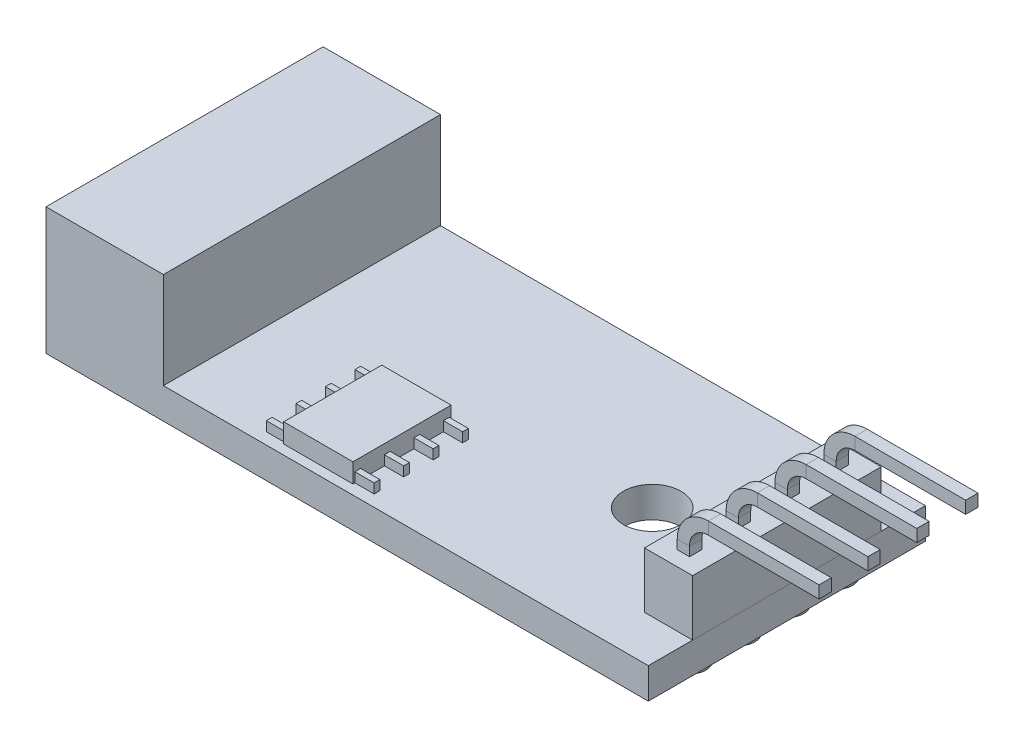
from build123d import *

# Parameters (mm, degrees)
CROQUIS1_W              = 31.3
CROQUIS1_H              = 14.4
CROQUIS1_R              = 1.5
BASE_DEPTH              = 1.6
CROQUIS2_W              = 2.5
CROQUIS2_H              = 9.8
BASE_PINES_DEPTH        = 2.9
SECCION_W               = 0.64
SECCION_H               = 0.64
MATRIZL1_COUNT          = 4
MATRIZL1_PITCH          = 2.54
CROQUIS7_W              = 3.6
CROQUIS7_H              = 5.1
SALIENTE_EXTRUIR4_DEPTH = 1
CROQUIS8_W              = 1
CROQUIS8_H              = 0.3
SALIENTE_EXTRUIR5_DEPTH = 0.5
CROQUIS9_R              = 0.85
SALIENTE_EXTRUIR6_DEPTH = 0.5
CROQUIS5_W              = 6.1
CROQUIS5_H              = 14.4
BOSS_EXTRUDE1_DEPTH     = 5


with BuildPart() as part:
    # Croquis1 → BASE (new body)
    with BuildSketch(Plane(origin=(0, 0, 0), x_dir=(1, 0, 0), z_dir=(0, 1, 0))):
        Rectangle(CROQUIS1_W, CROQUIS1_H)
        with Locations(Location((8.65, 0, 0), (0, 0, 270))):
            Circle(CROQUIS1_R, mode=Mode.SUBTRACT)
    extrude(amount=BASE_DEPTH)

    # Croquis9 → Saliente-Extruir6 (add)
    with BuildSketch(Plane.XZ):
        with Locations(Location((-13.15, 5.15, 0), (0, 0, 270))):
            Circle(CROQUIS9_R)
        with Locations(Location((-10.575, 5.15, 0), (0, 0, 270))):
            Circle(CROQUIS9_R)
        with Locations(Location((-10.575, 2.575, 0), (0, 0, 270))):
            Circle(CROQUIS9_R)
        with Locations(Location((-13.15, 2.575, 0), (0, 0, 270))):
            Circle(CROQUIS9_R)
        with Locations(Location((-13.15, 0, 0), (0, 0, 270))):
            Circle(CROQUIS9_R)
        with Locations(Location((-13.15, -2.575, 0), (0, 0, 270))):
            Circle(CROQUIS9_R)
        with Locations(Location((-13.15, -5.15, 0), (0, 0, 270))):
            Circle(CROQUIS9_R)
        with Locations(Location((-10.575, -5.15, 0), (0, 0, 270))):
            Circle(CROQUIS9_R)
        with Locations(Location((-10.575, -2.575, 0), (0, 0, 270))):
            Circle(CROQUIS9_R)
        with Locations(Location((14.4, 3.81, 0), (0, 0, 270))):
            Circle(CROQUIS9_R)
        with Locations(Location((14.4, 1.27, 0), (0, 0, 270))):
            Circle(CROQUIS9_R)
        with Locations(Location((14.4, -1.27, 0), (0, 0, 270))):
            Circle(CROQUIS9_R)
        with Locations(Location((14.4, -3.81, 0), (0, 0, 270))):
            Circle(CROQUIS9_R)
    extrude(amount=SALIENTE_EXTRUIR6_DEPTH)

    # Croquis5 → Boss-Extrude1 (add)
    with BuildSketch(Plane(origin=(0, 1.6, 0), x_dir=(1, 0, 0), z_dir=(0, 1, 0))):
        with Locations((-12.6, 0)):
            Rectangle(CROQUIS5_W, CROQUIS5_H)
    extrude(amount=BOSS_EXTRUDE1_DEPTH)


with BuildPart() as body_2:
    # Croquis2 → BASE PINES (new body)
    with BuildSketch(Plane(origin=(0, 1.6, 0), x_dir=(1, 0, 0), z_dir=(0, 1, 0))):
        with Locations((14.4, 0)):
            Rectangle(CROQUIS2_W, CROQUIS2_H)
    extrude(amount=BASE_PINES_DEPTH)


with BuildPart() as body_3:
    # PIN Vcc: sweep along a path in DIRECTRIZ
    with BuildLine(Plane.XY.offset(-3.81)) as pin_vcc_path:
        Line((14.4, 4.5), (14.4, 4.98))
        ThreePointArc((14.4, 4.98), (14.780761184, 5.899238816), (15.7, 6.28))
        Line((15.7, 6.28), (21.45, 6.28))
    # SECCION → PIN Vcc (sweep)
    with BuildSketch(Plane(origin=(0, 4.5, 0), x_dir=(1, 0, 0), z_dir=(0, 1, 0))):
        with Locations((14.4, 3.81)):
            Rectangle(SECCION_W, SECCION_H)
    sweep(path=pin_vcc_path.line)


with BuildPart() as matrizl1_1:
    # MatrizL1: pattern copy
    add(body_3.part.moved(Location(Vector(0, 0, 1) * (1 * MATRIZL1_PITCH))))


with BuildPart() as matrizl1_2:
    # MatrizL1: pattern copy
    add(body_3.part.moved(Location(Vector(0, 0, 1) * (2 * MATRIZL1_PITCH))))


with BuildPart() as matrizl1_3:
    # MatrizL1: pattern copy
    add(body_3.part.moved(Location(Vector(0, 0, 1) * (3 * MATRIZL1_PITCH))))


with BuildPart() as body_7:
    # Croquis7 → Saliente-Extruir4 (new body)
    with BuildSketch(Plane(origin=(0, 1.6, 0), x_dir=(1, 0, 0), z_dir=(0, 1, 0))):
        with Locations((-2, -4.15)):
            Rectangle(CROQUIS7_W, CROQUIS7_H)
    extrude(amount=SALIENTE_EXTRUIR4_DEPTH)

    # Croquis8 → Saliente-Extruir5 (add)
    with BuildSketch(Plane(origin=(0, 1.6, 0), x_dir=(1, 0, 0), z_dir=(0, 1, 0))):
        with Locations((-4.3, -1.85)):
            Rectangle(CROQUIS8_W, CROQUIS8_H)
        with Locations((-4.3, -3.383333333)):
            Rectangle(CROQUIS8_W, CROQUIS8_H)
        with Locations((-4.3, -4.916666667)):
            Rectangle(CROQUIS8_W, CROQUIS8_H)
        with Locations((-4.3, -6.45)):
            Rectangle(CROQUIS8_W, CROQUIS8_H)
        with Locations((0.3, -1.85)):
            Rectangle(CROQUIS8_W, CROQUIS8_H)
        with Locations((0.3, -3.383333333)):
            Rectangle(CROQUIS8_W, CROQUIS8_H)
        with Locations((0.3, -4.916666667)):
            Rectangle(CROQUIS8_W, CROQUIS8_H)
        with Locations((0.3, -6.45)):
            Rectangle(CROQUIS8_W, CROQUIS8_H)
    extrude(amount=SALIENTE_EXTRUIR5_DEPTH)


solid = Compound([part.part, body_2.part, body_3.part, matrizl1_1.part, matrizl1_2.part, matrizl1_3.part, body_7.part])
